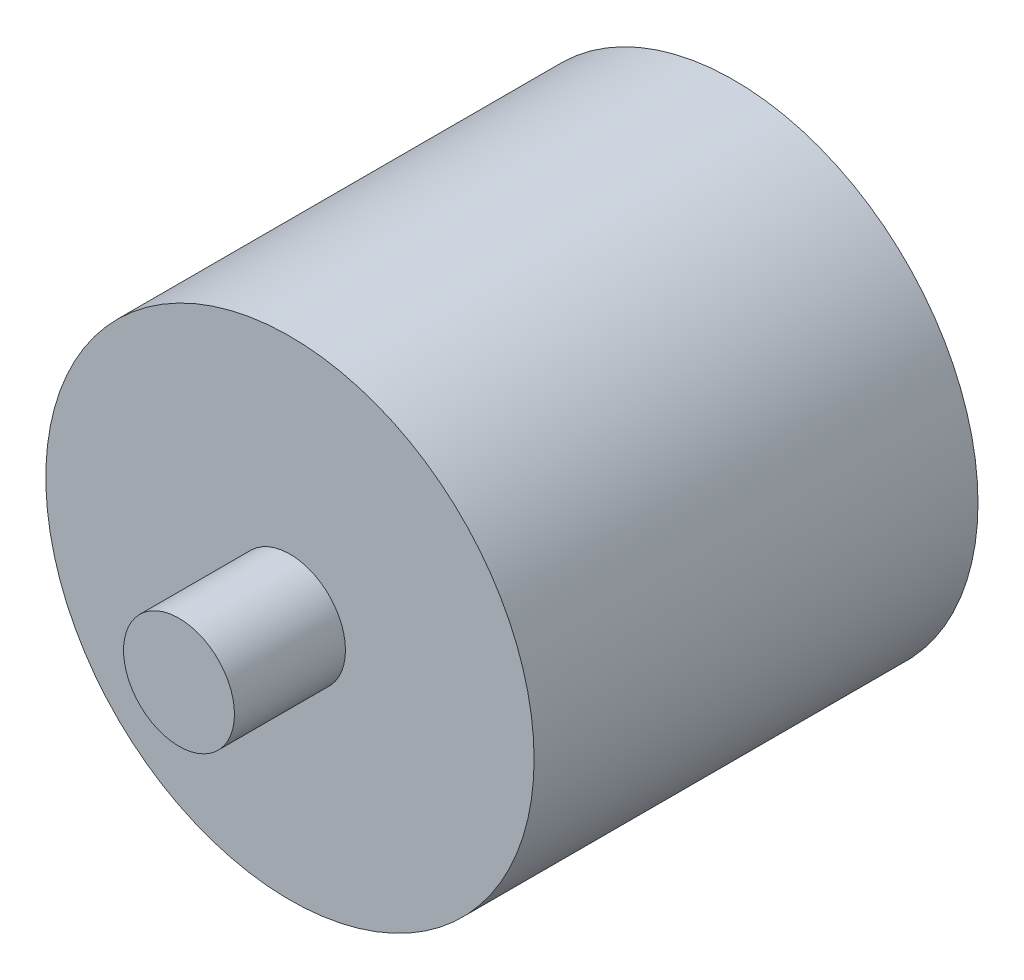
from build123d import *

# Parameters (mm, degrees)
SKETCH1_R           = 11
BOSS_EXTRUDE1_DEPTH = 20
SKETCH2_R           = 2.5
BOSS_EXTRUDE2_DEPTH = 5


with BuildPart() as part:
    # Sketch1 → Boss-Extrude1 (new body)
    with BuildSketch(Plane.XY):
        Circle(SKETCH1_R)
    extrude(amount=BOSS_EXTRUDE1_DEPTH)

    # Sketch2 → Boss-Extrude2 (add)
    with BuildSketch(Plane.XY.offset(20)):
        Circle(SKETCH2_R)
    extrude(amount=BOSS_EXTRUDE2_DEPTH)


solid = part.part
